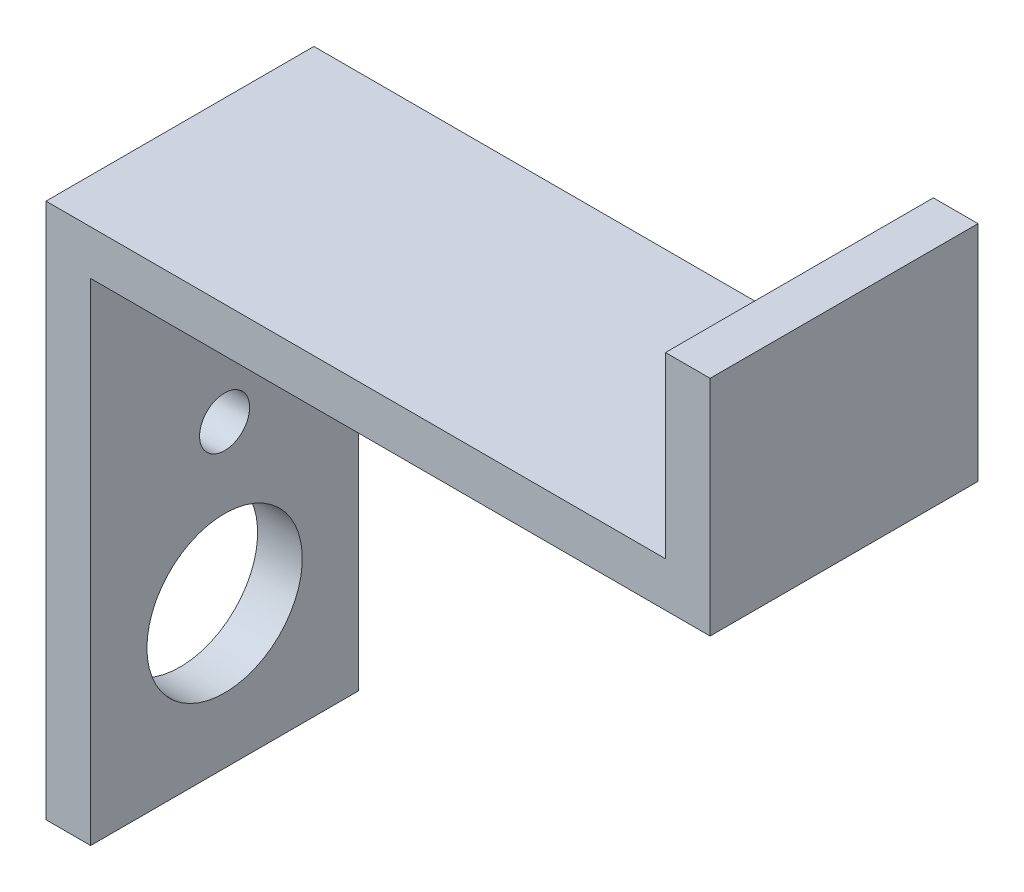
from build123d import *

# Parameters (mm, degrees)
BOSS_EXTRUDE1_DEPTH = 38.1
SKETCH2_R           = 11.049
CUT_EXTRUDE1_DEPTH  = 6.35
SKETCH2_4_R         = 3.556
CUT_EXTRUDE2_DEPTH  = 6.35


with BuildPart() as part:
    # Sketch1 → Boss-Extrude1 (new body)
    with BuildSketch(Plane.XY):
        Polygon((0, 76.2), (0, 0), (6.35, 0), (6.35, 69.85), (94.447991824, 69.85), (94.447991824, 101.6), (88.097991824, 101.6), (88.097991824, 76.2), align=None)
    extrude(amount=BOSS_EXTRUDE1_DEPTH)

    # Sketch2 → Cut-Extrude1 (cut)
    with BuildSketch(Plane.ZY):
        with Locations((19.05, 20.32)):
            Circle(SKETCH2_R)
    extrude(amount=-CUT_EXTRUDE1_DEPTH, mode=Mode.SUBTRACT)

    # Sketch2<4> → Cut-Extrude2 (cut)
    with BuildSketch(Plane.ZY):
        with Locations((19.05, 42.672)):
            Circle(SKETCH2_4_R)
    extrude(amount=-CUT_EXTRUDE2_DEPTH, mode=Mode.SUBTRACT)


solid = part.part
